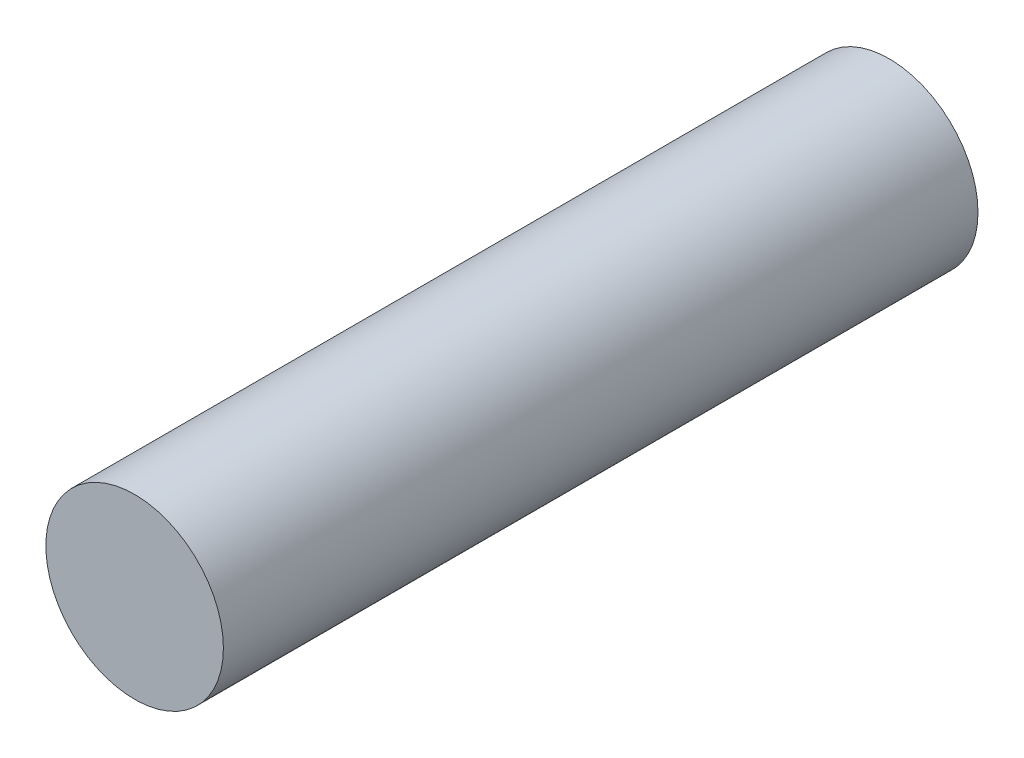
from build123d import *

# Parameters (mm, degrees)
SKETCH_1_R      = 2
EXTRUDE_1_DEPTH = 17


with BuildPart() as part:
    # 草图1 → 凸台-拉伸1 (new body)
    with BuildSketch(Plane.XY):
        Circle(SKETCH_1_R)
    extrude(amount=EXTRUDE_1_DEPTH)


solid = part.part
